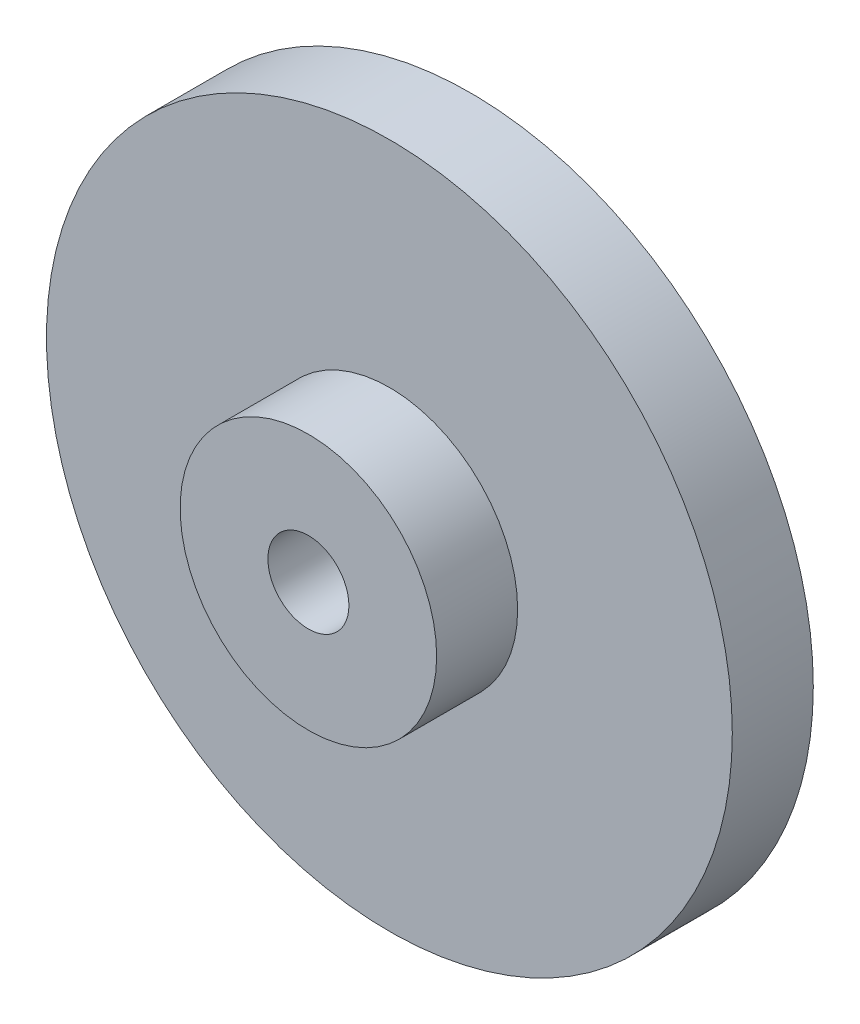
from build123d import *

# Parameters (mm, degrees)
SKETCH1_R           = 25.4
BOSS_EXTRUDE1_DEPTH = 6
SKETCH4_R           = 9.5
BOSS_EXTRUDE2_DEPTH = 6
CUT_EXTRUDE1_REACH  = 39.872
SKETCH6_R           = 3


with BuildPart() as part:
    # Sketch1 → Boss-Extrude1 (new body)
    with BuildSketch(Plane.XY):
        Circle(SKETCH1_R)
    extrude(amount=BOSS_EXTRUDE1_DEPTH)

    # Sketch4 → Boss-Extrude2 (add)
    with BuildSketch(Plane.XY.offset(6)):
        Circle(SKETCH4_R)
    extrude(amount=BOSS_EXTRUDE2_DEPTH)

    # Sketch6 → Cut-Extrude1 (cut, up to next)
    with BuildSketch(Plane.XY, mode=Mode.PRIVATE) as cut_extrude1_sk1:
        Circle(SKETCH6_R)
    cut_extrude1_tool1 = extrude(cut_extrude1_sk1.sketch, amount=CUT_EXTRUDE1_REACH, mode=Mode.PRIVATE) & part.part
    add(cut_extrude1_tool1.solids().sort_by_distance((0, 0, 0))[0], mode=Mode.SUBTRACT)


solid = part.part
